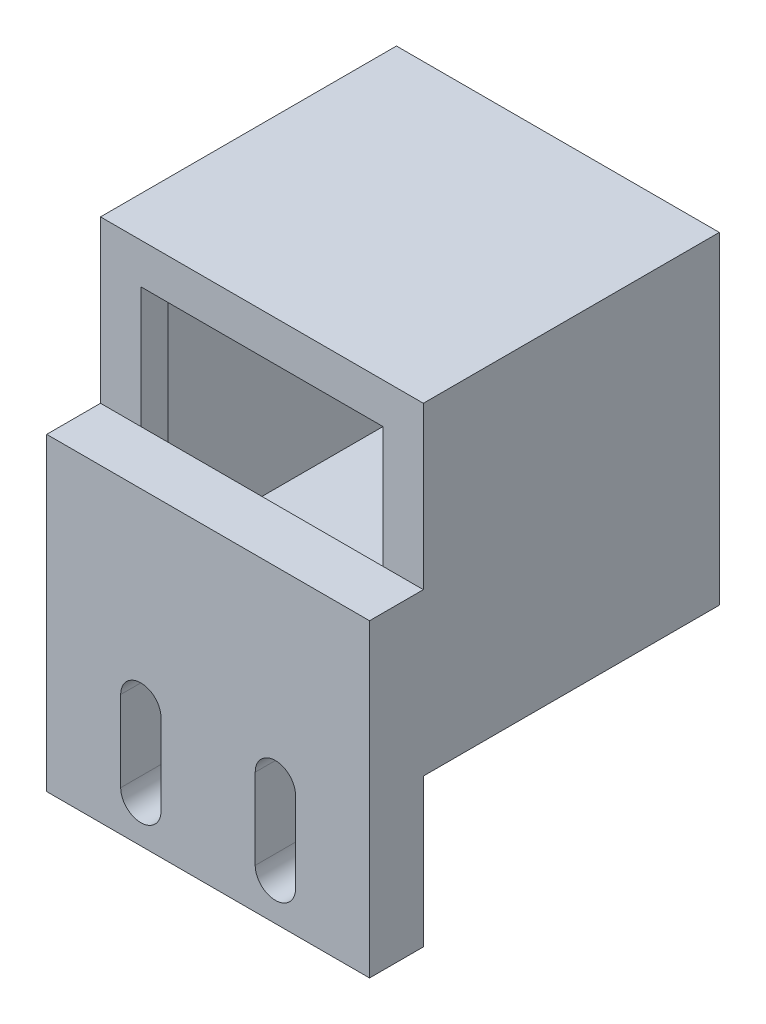
from build123d import *

# Parameters (mm, degrees)
SKETCH_1_W          = 24
SKETCH_1_H          = 24
EXTRUDE_2_DEPTH     = 20
SKETCH_3_W          = 21
SKETCH_3_H          = 21
CUT_EXTRUDE_1_DEPTH = 20
SKETCH_4_W          = 24
SKETCH_4_H          = 3
EXTRUDE_8_DEPTH     = 2
SKETCH_8_W          = 3
SKETCH_8_H          = 21
EXTRUDE_9_DEPTH     = 2
SKETCH_9_W          = 21
SKETCH_9_H          = 3
EXTRUDE_10_DEPTH    = 2
SKETCH_10_W         = 3
SKETCH_10_H         = 18
EXTRUDE_11_DEPTH    = 2
SKETCH_11_W         = 24
SKETCH_11_H         = 23
EXTRUDE_12_DEPTH    = 4
CUT_EXTRUDE_2_DEPTH = 4


with BuildPart() as part:
    # 草图1 → 凸台-拉伸2 (new body)
    with BuildSketch(Plane.XY):
        Rectangle(SKETCH_1_W, SKETCH_1_H)
    extrude(amount=EXTRUDE_2_DEPTH)

    # 草图3 → 切除-拉伸1 (cut)
    with BuildSketch(Plane.XY.offset(20)):
        Rectangle(SKETCH_3_W, SKETCH_3_H)
    extrude(amount=-CUT_EXTRUDE_1_DEPTH, mode=Mode.SUBTRACT)

    # 草图4 → 凸台-拉伸8 (add)
    with BuildSketch(Plane.XY.offset(20)):
        with Locations((0, 10.5)):
            Rectangle(SKETCH_4_W, SKETCH_4_H)
    extrude(amount=EXTRUDE_8_DEPTH)

    # 草图8 → 凸台-拉伸9 (add)
    with BuildSketch(Plane.XY.offset(20)):
        with Locations((-10.5, -1.5)):
            Rectangle(SKETCH_8_W, SKETCH_8_H)
    extrude(amount=EXTRUDE_9_DEPTH)

    # 草图9 → 凸台-拉伸10 (add)
    with BuildSketch(Plane.XY.offset(20)):
        with Locations((1.5, -10.5)):
            Rectangle(SKETCH_9_W, SKETCH_9_H)
    extrude(amount=EXTRUDE_10_DEPTH)

    # 草图10 → 凸台-拉伸11 (add)
    with BuildSketch(Plane.XY.offset(20)):
        with Locations((10.5, 0)):
            Rectangle(SKETCH_10_W, SKETCH_10_H)
    extrude(amount=EXTRUDE_11_DEPTH)

    # 草图11 → 凸台-拉伸12 (add)
    with BuildSketch(Plane.XY.offset(22)):
        with Locations((0, -11.5)):
            Rectangle(SKETCH_11_W, SKETCH_11_H)
    extrude(amount=EXTRUDE_12_DEPTH)

    # 草图12 → 切除-拉伸2 (cut)
    with BuildSketch(Plane.XY.offset(26)):
        with BuildLine():
            Line((-3.5, -14), (-3.5, -20))
            ThreePointArc((-3.5, -20), (-5, -21.5), (-6.5, -20))
            Line((-6.5, -20), (-6.5, -14))
            ThreePointArc((-6.5, -14), (-5, -12.5), (-3.5, -14))
        make_face()
        with BuildLine():
            Line((3.5, -14), (3.5, -20))
            ThreePointArc((3.5, -20), (5, -21.5), (6.5, -20))
            Line((6.5, -20), (6.5, -14))
            ThreePointArc((6.5, -14), (5, -12.5), (3.5, -14))
        make_face()
    extrude(amount=-CUT_EXTRUDE_2_DEPTH, mode=Mode.SUBTRACT)


solid = part.part
